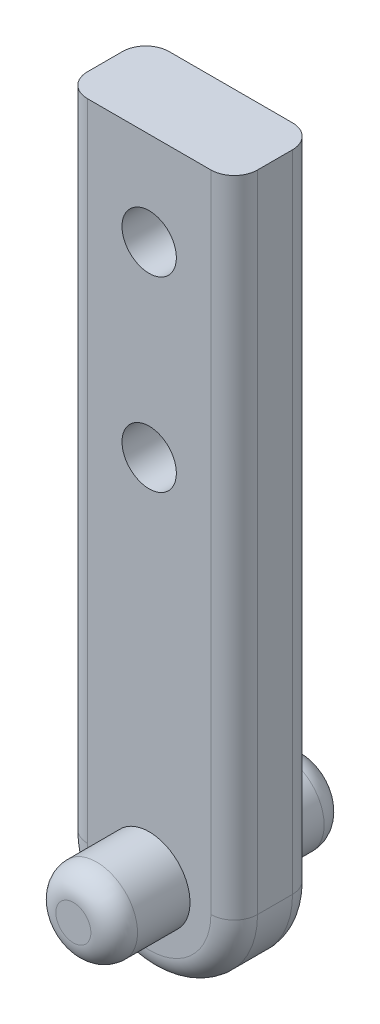
from build123d import *

# Parameters (mm, degrees)
BOSS_EXTRUDE1_DEPTH          = 2.778125
BOSS_EXTRUDE1_DEPTH_BACK     = 2.778125
SKETCH2_R                    = 2.778125
BOSS_EXTRUDE2_DEPTH          = 7.9375
F_97_0_0059_DIAMETER_HOLE1_D = 3.699999966
FILLET1_R                    = 1.5875
FILLET2_R                    = 1.5875


with BuildPart() as part:
    # Sketch1 → Boss-Extrude1 (new, two sides: drawn at the far end of the back side and taken through both)
    with BuildSketch(Plane.XY.offset(-BOSS_EXTRUDE1_DEPTH_BACK)):
        with BuildLine():
            Line((20.579185749, 13.663463824), (20.579185749, 57.551094031))
            Line((20.579185749, 57.551094031), (9.003925336, 57.551094031))
            Line((9.003925336, 57.551094031), (9.003925336, 13.663463824))
            ThreePointArc((9.003925336, 13.663463824), (14.791555542, 7.875833618), (20.579185749, 13.663463824))
        make_face()
    extrude(amount=BOSS_EXTRUDE1_DEPTH + BOSS_EXTRUDE1_DEPTH_BACK)

    # Sketch2 → Boss-Extrude2 (add, symmetric)
    with BuildSketch(Plane.XY):
        with Locations(Location((14.791555542, 13.663463824, 0), (0, 0, 180))):
            Circle(SKETCH2_R)
    extrude(amount=BOSS_EXTRUDE2_DEPTH, both=True)

    # #97 (0.0059) Diameter Hole1 (through all)
    with Locations(Plane.XY.offset(2.778125)):
        with Locations((14.791555542, 51.201094031), (14.791555542, 38.501094031)):
            Hole(F_97_0_0059_DIAMETER_HOLE1_D / 2)

    # Fillet1
    fillet1_edges = [part.edges().sort_by_distance(p)[0] for p in [
        (17.569680542, 13.663463824, -7.9375),
        (17.569680542, 13.663463824, 7.9375),
    ]]
    fillet(fillet1_edges, radius=FILLET1_R)

    # Fillet2
    fillet2_edges = [part.edges().sort_by_distance(p)[0] for p in [
        (9.003925336, 35.607278928, 2.778125),
        (20.579185749, 35.607278928, 2.778125),
        (14.791555542, 7.875833618, 2.778125),
        (20.579185749, 35.607278928, -2.778125),
        (9.003925336, 35.607278928, -2.778125),
        (14.791555542, 7.875833618, -2.778125),
    ]]
    fillet(fillet2_edges, radius=FILLET2_R)


solid = part.part
